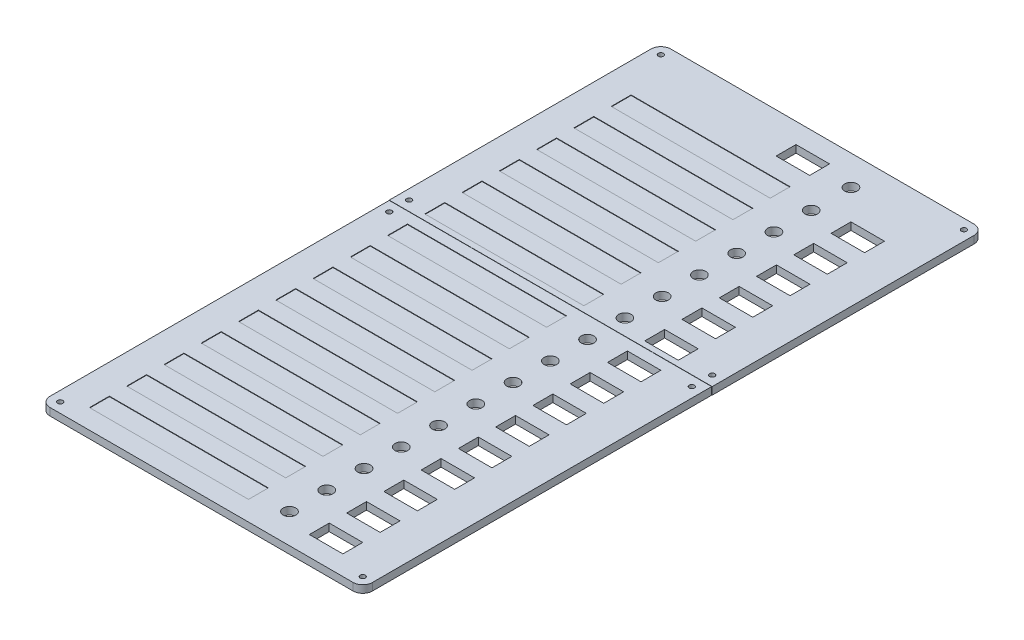
from build123d import *

# Parameters (mm, degrees)
SKIZZE1_W                                    = 130
SKIZZE1_H                                    = 250
AUFSATZ_LINEAR_AUSTRAGEN1_DEPTH              = 3
VERRUNDUNG1_R                                = 4
SCHNITT_LINEAR_AUSTRAGEN_D_NN1_DEPTH         = 3
F_2_1_2_1_DURCHMESSER_BOHRUNG1_AT_2_COUNT    = 2
F_2_1_2_1_DURCHMESSER_BOHRUNG1_AT_2_PITCH    = 122
F_2_1_2_1_DURCHMESSER_BOHRUNG1_AT_3_COUNT    = 2
F_2_1_2_1_DURCHMESSER_BOHRUNG1_AT_3_PITCH    = 158.602290477
F_2_1_2_1_DURCHMESSER_BOHRUNG1_AT_4_COUNT    = 2
F_2_1_2_1_DURCHMESSER_BOHRUNG1_AT_4_PITCH    = 163.822116197
F_2_1_2_1_DURCHMESSER_BOHRUNG1_AT_5_COUNT    = 2
F_2_1_2_1_DURCHMESSER_BOHRUNG1_AT_5_PITCH    = 101.344395723
F_2_1_2_1_DURCHMESSER_BOHRUNG1_AT_6_COUNT    = 2
F_2_1_2_1_DURCHMESSER_BOHRUNG1_AT_6_PITCH    = 109.444441408
F_2_1_2_1_DURCHMESSER_BOHRUNG1_AT_7_COUNT    = 2
F_2_1_2_1_DURCHMESSER_BOHRUNG1_AT_7_PITCH    = 241.90002067
F_2_1_2_1_DURCHMESSER_BOHRUNG1_AT_8_COUNT    = 2
F_2_1_2_1_DURCHMESSER_BOHRUNG1_AT_8_PITCH    = 270.878607498
SKIZZE5_W                                    = 13.5
SKIZZE5_H                                    = 8
SCHNITT_LINEAR_AUSTRAGEN3_DEPTH              = 3
F_5_05_5_05_DURCHMESSER_BOHRUNG1_AT_2_COUNT  = 2
F_5_05_5_05_DURCHMESSER_BOHRUNG1_AT_2_PITCH  = 15
F_5_05_5_05_DURCHMESSER_BOHRUNG1_AT_3_COUNT  = 2
F_5_05_5_05_DURCHMESSER_BOHRUNG1_AT_3_PITCH  = 30
F_5_05_5_05_DURCHMESSER_BOHRUNG1_AT_4_COUNT  = 2
F_5_05_5_05_DURCHMESSER_BOHRUNG1_AT_4_PITCH  = 45
F_5_05_5_05_DURCHMESSER_BOHRUNG1_AT_5_COUNT  = 2
F_5_05_5_05_DURCHMESSER_BOHRUNG1_AT_5_PITCH  = 60
F_5_05_5_05_DURCHMESSER_BOHRUNG1_AT_6_COUNT  = 2
F_5_05_5_05_DURCHMESSER_BOHRUNG1_AT_6_PITCH  = 75
F_5_05_5_05_DURCHMESSER_BOHRUNG1_AT_7_COUNT  = 2
F_5_05_5_05_DURCHMESSER_BOHRUNG1_AT_7_PITCH  = 90
F_5_05_5_05_DURCHMESSER_BOHRUNG1_AT_8_COUNT  = 2
F_5_05_5_05_DURCHMESSER_BOHRUNG1_AT_8_PITCH  = 105
F_5_05_5_05_DURCHMESSER_BOHRUNG1_AT_9_COUNT  = 2
F_5_05_5_05_DURCHMESSER_BOHRUNG1_AT_9_PITCH  = 120
F_5_05_5_05_DURCHMESSER_BOHRUNG1_AT_10_COUNT = 2
F_5_05_5_05_DURCHMESSER_BOHRUNG1_AT_10_PITCH = 135
F_5_05_5_05_DURCHMESSER_BOHRUNG1_AT_11_COUNT = 2
F_5_05_5_05_DURCHMESSER_BOHRUNG1_AT_11_PITCH = 150
F_5_05_5_05_DURCHMESSER_BOHRUNG1_AT_12_COUNT = 2
F_5_05_5_05_DURCHMESSER_BOHRUNG1_AT_12_PITCH = 165
F_5_05_5_05_DURCHMESSER_BOHRUNG1_AT_13_COUNT = 2
F_5_05_5_05_DURCHMESSER_BOHRUNG1_AT_13_PITCH = 180
F_5_05_5_05_DURCHMESSER_BOHRUNG1_AT_14_COUNT = 2
F_5_05_5_05_DURCHMESSER_BOHRUNG1_AT_14_PITCH = 195
F_5_05_5_05_DURCHMESSER_BOHRUNG1_AT_15_COUNT = 2
F_5_05_5_05_DURCHMESSER_BOHRUNG1_AT_15_PITCH = 210
SKIZZE8_W                                    = 64
SKIZZE8_H                                    = 8
SCHNITT_LINEAR_AUSTRAGEN4_DEPTH              = 0.2
SKIZZE12_W                                   = 13.5
SKIZZE12_H                                   = 8
SCHNITT_LINEAR_AUSTRAGEN5_DEPTH              = 3


with BuildPart() as part:
    # Skizze1 → Aufsatz-Linear austragen1 (new body)
    with BuildSketch(Plane(origin=(0, 0, 0), x_dir=(1, 0, 0), z_dir=(0, 1, 0))):
        Rectangle(SKIZZE1_W, SKIZZE1_H)
    extrude(amount=AUFSATZ_LINEAR_AUSTRAGEN1_DEPTH)

    # Verrundung1
    verrundung1_edges = [part.edges().sort_by_distance(p)[0] for p in [
        (65, 1.5, 125),
        (-65, 1.5, 125),
        (-65, 1.5, -125),
        (65, 1.5, -125),
    ]]
    fillet(verrundung1_edges, radius=VERRUNDUNG1_R)

    # Skizze2 → Schnitt-Linear-Austragen-Dünn1 (cut)
    with BuildSketch(Plane(origin=(0, 3, 0), x_dir=(1, 0, 0), z_dir=(0, 1, 0))):
        with BuildLine():
            Line((61, -125), (-61, -125))
            ThreePointArc((-61, -125), (-63.828427125, -123.828427125), (-65, -121))
            Line((-65, -121), (-65, 15.655604277))
            Line((-65, 15.655604277), (65, 15.655604277))
            Line((65, 15.655604277), (65, -121))
            ThreePointArc((65, -121), (63.828427125, -123.828427125), (61, -125))
        make_face()
        with BuildLine():
            Line((61, -124.9), (-61, -124.9))
            ThreePointArc((-61, -124.9), (-63.757716447, -123.757716447), (-64.9, -121))
            Line((-64.9, -121), (-64.9, 15.555604277))
            Line((-64.9, 15.555604277), (64.9, 15.555604277))
            Line((64.9, 15.555604277), (64.9, -121))
            ThreePointArc((64.9, -121), (63.757716447, -123.757716447), (61, -124.9))
        make_face(mode=Mode.SUBTRACT)
    extrude(amount=-SCHNITT_LINEAR_AUSTRAGEN_D_NN1_DEPTH, mode=Mode.SUBTRACT)


with BuildPart() as schnitt_linear_austragen_d_nn1_piece_1:
    # of the separate pieces the step leaves, piece 1, a body of its own (schnitt_linear_austragen_d_nn1_pieces)
    add(part.part.solids().sort_by_distance((64.9, 0, -15.555604277))[0])


with BuildPart() as schnitt_linear_austragen_d_nn1_piece_2:
    # of the separate pieces the step leaves, piece 2, a body of its own (schnitt_linear_austragen_d_nn1_pieces)
    add(part.part.solids().sort_by_distance((-65, 0, -121))[0])

    # Skizze4 → Ø2.1 (2.1) Durchmesser Bohrung1 (revolve, cut)
    with BuildSketch(Plane(origin=(-61, 3, -121), x_dir=(0, 0, 1), z_dir=(1, 0, 0))):
        Polygon((0, 0), (0, 3.63090365), (1.05, 3), (1.05, 0), align=None)
    f_2_1_2_1_durchmesser_bohrung1 = revolve(axis=Axis((-61, 9.35, -121), (0, -1, 0)), mode=Mode.SUBTRACT)

    # Ø2.1 (2.1) Durchmesser Bohrung1 at 2: Ø2.1 (2.1) Durchmesser Bohrung1 ×2
    with Locations(*[(i * F_2_1_2_1_DURCHMESSER_BOHRUNG1_AT_2_PITCH, 0, 0) for i in range(1, F_2_1_2_1_DURCHMESSER_BOHRUNG1_AT_2_COUNT)]):
        add(f_2_1_2_1_durchmesser_bohrung1, mode=Mode.SUBTRACT)

    # Ø2.1 (2.1) Durchmesser Bohrung1 at 3: Ø2.1 (2.1) Durchmesser Bohrung1 ×2
    with Locations(*[Vector(0.7692196602801709, 0, 0.6389844397467427) * (i * F_2_1_2_1_DURCHMESSER_BOHRUNG1_AT_3_PITCH) for i in range(1, F_2_1_2_1_DURCHMESSER_BOHRUNG1_AT_3_COUNT)]):
        add(f_2_1_2_1_durchmesser_bohrung1, mode=Mode.SUBTRACT)

    # Ø2.1 (2.1) Durchmesser Bohrung1 at 5: Ø2.1 (2.1) Durchmesser Bohrung1 ×2
    with Locations(*[(0, 0, i * F_2_1_2_1_DURCHMESSER_BOHRUNG1_AT_5_PITCH) for i in range(1, F_2_1_2_1_DURCHMESSER_BOHRUNG1_AT_5_COUNT)]):
        add(f_2_1_2_1_durchmesser_bohrung1, mode=Mode.SUBTRACT)


with BuildPart() as schnitt_linear_austragen_d_nn1_piece_1_1:
    add(schnitt_linear_austragen_d_nn1_piece_1.part)

    # Ø2.1 (2.1) Durchmesser Bohrung1 at 4: Ø2.1 (2.1) Durchmesser Bohrung1 ×2
    with Locations(*[Vector(0.744099776209552, 0, 0.668068501760781) * (i * F_2_1_2_1_DURCHMESSER_BOHRUNG1_AT_4_PITCH) for i in range(1, F_2_1_2_1_DURCHMESSER_BOHRUNG1_AT_4_COUNT)]):
        add(f_2_1_2_1_durchmesser_bohrung1, mode=Mode.SUBTRACT)

    # Ø2.1 (2.1) Durchmesser Bohrung1 at 6: Ø2.1 (2.1) Durchmesser Bohrung1 ×2
    with Locations(*[Vector(0.0009137056091065678, 0, 0.9999995825709429) * (i * F_2_1_2_1_DURCHMESSER_BOHRUNG1_AT_6_PITCH) for i in range(1, F_2_1_2_1_DURCHMESSER_BOHRUNG1_AT_6_COUNT)]):
        add(f_2_1_2_1_durchmesser_bohrung1, mode=Mode.SUBTRACT)

    # Ø2.1 (2.1) Durchmesser Bohrung1 at 7: Ø2.1 (2.1) Durchmesser Bohrung1 ×2
    with Locations(*[Vector(0.0004133939291247376, 0, 0.9999999145527261) * (i * F_2_1_2_1_DURCHMESSER_BOHRUNG1_AT_7_PITCH) for i in range(1, F_2_1_2_1_DURCHMESSER_BOHRUNG1_AT_7_COUNT)]):
        add(f_2_1_2_1_durchmesser_bohrung1, mode=Mode.SUBTRACT)

    # Ø2.1 (2.1) Durchmesser Bohrung1 at 8: Ø2.1 (2.1) Durchmesser Bohrung1 ×2
    with Locations(*[Vector(0.4500170800713607, 0, 0.8930199480661373) * (i * F_2_1_2_1_DURCHMESSER_BOHRUNG1_AT_8_PITCH) for i in range(1, F_2_1_2_1_DURCHMESSER_BOHRUNG1_AT_8_COUNT)]):
        add(f_2_1_2_1_durchmesser_bohrung1, mode=Mode.SUBTRACT)


with BuildPart() as schnitt_linear_austragen3_tool:
    # Skizze5 → Schnitt-Linear austragen3 (new body)
    with BuildSketch(Plane(origin=(0, 3, 0), x_dir=(1, 0, 0), z_dir=(0, 1, 0))):
        with Locations((42.25, 97)):
            Rectangle(SKIZZE5_W, SKIZZE5_H)
        with Locations((42.25, 82)):
            Rectangle(SKIZZE5_W, SKIZZE5_H)
        with Locations((42.25, 67)):
            Rectangle(SKIZZE5_W, SKIZZE5_H)
        with Locations((42.25, 52)):
            Rectangle(SKIZZE5_W, SKIZZE5_H)
        with Locations((42.25, 37)):
            Rectangle(SKIZZE5_W, SKIZZE5_H)
        with Locations((42.25, 22)):
            Rectangle(SKIZZE5_W, SKIZZE5_H)
        with Locations((42.25, 7)):
            Rectangle(SKIZZE5_W, SKIZZE5_H)
        with Locations((42.25, -8)):
            Rectangle(SKIZZE5_W, SKIZZE5_H)
        with Locations((42.25, -23)):
            Rectangle(SKIZZE5_W, SKIZZE5_H)
        with Locations((42.25, -38)):
            Rectangle(SKIZZE5_W, SKIZZE5_H)
        with Locations((42.25, -53)):
            Rectangle(SKIZZE5_W, SKIZZE5_H)
        with Locations((42.25, -68)):
            Rectangle(SKIZZE5_W, SKIZZE5_H)
        with Locations((42.25, -83)):
            Rectangle(SKIZZE5_W, SKIZZE5_H)
        with Locations((42.25, -98)):
            Rectangle(SKIZZE5_W, SKIZZE5_H)
        with Locations((42.25, -113)):
            Rectangle(SKIZZE5_W, SKIZZE5_H)
    extrude(amount=-SCHNITT_LINEAR_AUSTRAGEN3_DEPTH)


with BuildPart() as schnitt_linear_austragen_d_nn1_piece_1_2:
    add(schnitt_linear_austragen_d_nn1_piece_1_1.part)

    # Schnitt-Linear austragen3: cut by schnitt_linear_austragen3_tool
    add(schnitt_linear_austragen3_tool.part, mode=Mode.SUBTRACT)


with BuildPart() as schnitt_linear_austragen_d_nn1_piece_2_1:
    add(schnitt_linear_austragen_d_nn1_piece_2.part)

    # Schnitt-Linear austragen3: cut by schnitt_linear_austragen3_tool
    add(schnitt_linear_austragen3_tool.part, mode=Mode.SUBTRACT)

    # Skizze7 → Ø5.05 (5.05) Durchmesser Bohrung1 (revolve, cut)
    with BuildSketch(Plane(origin=(23.5, 3, -97), x_dir=(0, 0, 1), z_dir=(1, 0, 0))):
        Polygon((0, 0), (0, 4.517173063), (2.525, 3), (2.525, 0), align=None)
    f_5_05_5_05_durchmesser_bohrung1 = revolve(axis=Axis((23.5, 9.35, -97), (0, -1, 0)), mode=Mode.SUBTRACT)

    # Ø5.05 (5.05) Durchmesser Bohrung1 at 2: Ø5.05 (5.05) Durchmesser Bohrung1 ×2
    with Locations(*[(0, 0, i * F_5_05_5_05_DURCHMESSER_BOHRUNG1_AT_2_PITCH) for i in range(1, F_5_05_5_05_DURCHMESSER_BOHRUNG1_AT_2_COUNT)]):
        add(f_5_05_5_05_durchmesser_bohrung1, mode=Mode.SUBTRACT)

    # Ø5.05 (5.05) Durchmesser Bohrung1 at 3: Ø5.05 (5.05) Durchmesser Bohrung1 ×2
    with Locations(*[(0, 0, i * F_5_05_5_05_DURCHMESSER_BOHRUNG1_AT_3_PITCH) for i in range(1, F_5_05_5_05_DURCHMESSER_BOHRUNG1_AT_3_COUNT)]):
        add(f_5_05_5_05_durchmesser_bohrung1, mode=Mode.SUBTRACT)

    # Ø5.05 (5.05) Durchmesser Bohrung1 at 4: Ø5.05 (5.05) Durchmesser Bohrung1 ×2
    with Locations(*[(0, 0, i * F_5_05_5_05_DURCHMESSER_BOHRUNG1_AT_4_PITCH) for i in range(1, F_5_05_5_05_DURCHMESSER_BOHRUNG1_AT_4_COUNT)]):
        add(f_5_05_5_05_durchmesser_bohrung1, mode=Mode.SUBTRACT)

    # Ø5.05 (5.05) Durchmesser Bohrung1 at 5: Ø5.05 (5.05) Durchmesser Bohrung1 ×2
    with Locations(*[(0, 0, i * F_5_05_5_05_DURCHMESSER_BOHRUNG1_AT_5_PITCH) for i in range(1, F_5_05_5_05_DURCHMESSER_BOHRUNG1_AT_5_COUNT)]):
        add(f_5_05_5_05_durchmesser_bohrung1, mode=Mode.SUBTRACT)

    # Ø5.05 (5.05) Durchmesser Bohrung1 at 6: Ø5.05 (5.05) Durchmesser Bohrung1 ×2
    with Locations(*[(0, 0, i * F_5_05_5_05_DURCHMESSER_BOHRUNG1_AT_6_PITCH) for i in range(1, F_5_05_5_05_DURCHMESSER_BOHRUNG1_AT_6_COUNT)]):
        add(f_5_05_5_05_durchmesser_bohrung1, mode=Mode.SUBTRACT)


with BuildPart() as schnitt_linear_austragen_d_nn1_piece_1_3:
    add(schnitt_linear_austragen_d_nn1_piece_1_2.part)

    # Ø5.05 (5.05) Durchmesser Bohrung1 at 7: Ø5.05 (5.05) Durchmesser Bohrung1 ×2
    with Locations(*[(0, 0, i * F_5_05_5_05_DURCHMESSER_BOHRUNG1_AT_7_PITCH) for i in range(1, F_5_05_5_05_DURCHMESSER_BOHRUNG1_AT_7_COUNT)]):
        add(f_5_05_5_05_durchmesser_bohrung1, mode=Mode.SUBTRACT)

    # Ø5.05 (5.05) Durchmesser Bohrung1 at 8: Ø5.05 (5.05) Durchmesser Bohrung1 ×2
    with Locations(*[(0, 0, i * F_5_05_5_05_DURCHMESSER_BOHRUNG1_AT_8_PITCH) for i in range(1, F_5_05_5_05_DURCHMESSER_BOHRUNG1_AT_8_COUNT)]):
        add(f_5_05_5_05_durchmesser_bohrung1, mode=Mode.SUBTRACT)

    # Ø5.05 (5.05) Durchmesser Bohrung1 at 9: Ø5.05 (5.05) Durchmesser Bohrung1 ×2
    with Locations(*[(0, 0, i * F_5_05_5_05_DURCHMESSER_BOHRUNG1_AT_9_PITCH) for i in range(1, F_5_05_5_05_DURCHMESSER_BOHRUNG1_AT_9_COUNT)]):
        add(f_5_05_5_05_durchmesser_bohrung1, mode=Mode.SUBTRACT)

    # Ø5.05 (5.05) Durchmesser Bohrung1 at 10: Ø5.05 (5.05) Durchmesser Bohrung1 ×2
    with Locations(*[(0, 0, i * F_5_05_5_05_DURCHMESSER_BOHRUNG1_AT_10_PITCH) for i in range(1, F_5_05_5_05_DURCHMESSER_BOHRUNG1_AT_10_COUNT)]):
        add(f_5_05_5_05_durchmesser_bohrung1, mode=Mode.SUBTRACT)

    # Ø5.05 (5.05) Durchmesser Bohrung1 at 11: Ø5.05 (5.05) Durchmesser Bohrung1 ×2
    with Locations(*[(0, 0, i * F_5_05_5_05_DURCHMESSER_BOHRUNG1_AT_11_PITCH) for i in range(1, F_5_05_5_05_DURCHMESSER_BOHRUNG1_AT_11_COUNT)]):
        add(f_5_05_5_05_durchmesser_bohrung1, mode=Mode.SUBTRACT)

    # Ø5.05 (5.05) Durchmesser Bohrung1 at 12: Ø5.05 (5.05) Durchmesser Bohrung1 ×2
    with Locations(*[(0, 0, i * F_5_05_5_05_DURCHMESSER_BOHRUNG1_AT_12_PITCH) for i in range(1, F_5_05_5_05_DURCHMESSER_BOHRUNG1_AT_12_COUNT)]):
        add(f_5_05_5_05_durchmesser_bohrung1, mode=Mode.SUBTRACT)

    # Ø5.05 (5.05) Durchmesser Bohrung1 at 13: Ø5.05 (5.05) Durchmesser Bohrung1 ×2
    with Locations(*[(0, 0, i * F_5_05_5_05_DURCHMESSER_BOHRUNG1_AT_13_PITCH) for i in range(1, F_5_05_5_05_DURCHMESSER_BOHRUNG1_AT_13_COUNT)]):
        add(f_5_05_5_05_durchmesser_bohrung1, mode=Mode.SUBTRACT)

    # Ø5.05 (5.05) Durchmesser Bohrung1 at 14: Ø5.05 (5.05) Durchmesser Bohrung1 ×2
    with Locations(*[(0, 0, i * F_5_05_5_05_DURCHMESSER_BOHRUNG1_AT_14_PITCH) for i in range(1, F_5_05_5_05_DURCHMESSER_BOHRUNG1_AT_14_COUNT)]):
        add(f_5_05_5_05_durchmesser_bohrung1, mode=Mode.SUBTRACT)

    # Ø5.05 (5.05) Durchmesser Bohrung1 at 15: Ø5.05 (5.05) Durchmesser Bohrung1 ×2
    with Locations(*[(0, 0, i * F_5_05_5_05_DURCHMESSER_BOHRUNG1_AT_15_PITCH) for i in range(1, F_5_05_5_05_DURCHMESSER_BOHRUNG1_AT_15_COUNT)]):
        add(f_5_05_5_05_durchmesser_bohrung1, mode=Mode.SUBTRACT)


with BuildPart() as schnitt_linear_austragen4_tool:
    # Skizze8 → Schnitt-Linear austragen4 (new body)
    with BuildSketch(Plane(origin=(0, 3, 0), x_dir=(1, 0, 0), z_dir=(0, 1, 0))):
        with Locations((-21, 97)):
            Rectangle(SKIZZE8_W, SKIZZE8_H)
        with Locations((-21, 82)):
            Rectangle(SKIZZE8_W, SKIZZE8_H)
        with Locations((-21, 67)):
            Rectangle(SKIZZE8_W, SKIZZE8_H)
        with Locations((-21, 52)):
            Rectangle(SKIZZE8_W, SKIZZE8_H)
        with Locations((-21, 37)):
            Rectangle(SKIZZE8_W, SKIZZE8_H)
        with Locations((-21, 22)):
            Rectangle(SKIZZE8_W, SKIZZE8_H)
        with Locations((-21, 7)):
            Rectangle(SKIZZE8_W, SKIZZE8_H)
        with Locations((-21, -8)):
            Rectangle(SKIZZE8_W, SKIZZE8_H)
        with Locations((-21, -23)):
            Rectangle(SKIZZE8_W, SKIZZE8_H)
        with Locations((-21, -38)):
            Rectangle(SKIZZE8_W, SKIZZE8_H)
        with Locations((-21, -53)):
            Rectangle(SKIZZE8_W, SKIZZE8_H)
        with Locations((-21, -68)):
            Rectangle(SKIZZE8_W, SKIZZE8_H)
        with Locations((-21, -83)):
            Rectangle(SKIZZE8_W, SKIZZE8_H)
        with Locations((-21, -98)):
            Rectangle(SKIZZE8_W, SKIZZE8_H)
        with Locations((-21, -113)):
            Rectangle(SKIZZE8_W, SKIZZE8_H)
    extrude(amount=-SCHNITT_LINEAR_AUSTRAGEN4_DEPTH)


with BuildPart() as schnitt_linear_austragen_d_nn1_piece_1_4:
    add(schnitt_linear_austragen_d_nn1_piece_1_3.part)

    # Schnitt-Linear austragen4: cut by schnitt_linear_austragen4_tool
    add(schnitt_linear_austragen4_tool.part, mode=Mode.SUBTRACT)


with BuildPart() as schnitt_linear_austragen_d_nn1_piece_2_2:
    add(schnitt_linear_austragen_d_nn1_piece_2_1.part)

    # Schnitt-Linear austragen4: cut by schnitt_linear_austragen4_tool
    add(schnitt_linear_austragen4_tool.part, mode=Mode.SUBTRACT)

    # Skizze10 → Ø5.05 (5.05) Durchmesser Bohrung2 (revolve, cut)
    with BuildSketch(Plane(origin=(23.5, 3, -113), x_dir=(0, 0, 1), z_dir=(1, 0, 0))):
        Polygon((0, 0), (0, 4.517173063), (2.525, 3), (2.525, 0), align=None)
    revolve(axis=Axis((23.5, 9.35, -113), (0, -1, 0)), mode=Mode.SUBTRACT)

    # Skizze12 → Schnitt-Linear austragen5 (cut)
    with BuildSketch(Plane(origin=(0, 3, 0), x_dir=(1, 0, 0), z_dir=(0, 1, 0))):
        with Locations((4.25, 112.888990344)):
            Rectangle(SKIZZE12_W, SKIZZE12_H)
    extrude(amount=-SCHNITT_LINEAR_AUSTRAGEN5_DEPTH, mode=Mode.SUBTRACT)


solid = Compound([schnitt_linear_austragen_d_nn1_piece_1_4.part, schnitt_linear_austragen_d_nn1_piece_2_2.part])
